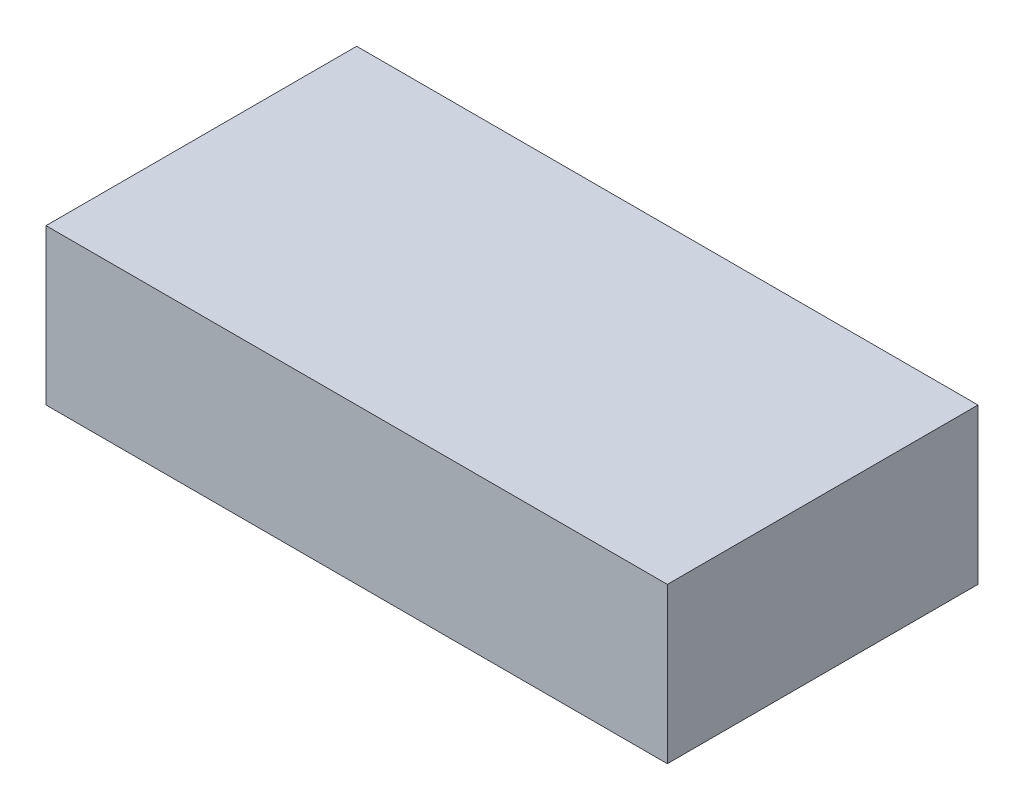
from build123d import *

# Parameters (mm, degrees)
SKETCH1_W           = 200
SKETCH1_H           = 100
BOSS_EXTRUDE1_DEPTH = 50


with BuildPart() as part:
    # Sketch1 → Boss-Extrude1 (new body)
    with BuildSketch(Plane(origin=(0, 0, 0), x_dir=(1, 0, 0), z_dir=(0, 1, 0))):
        Rectangle(SKETCH1_W, SKETCH1_H)
    extrude(amount=BOSS_EXTRUDE1_DEPTH)


solid = part.part
